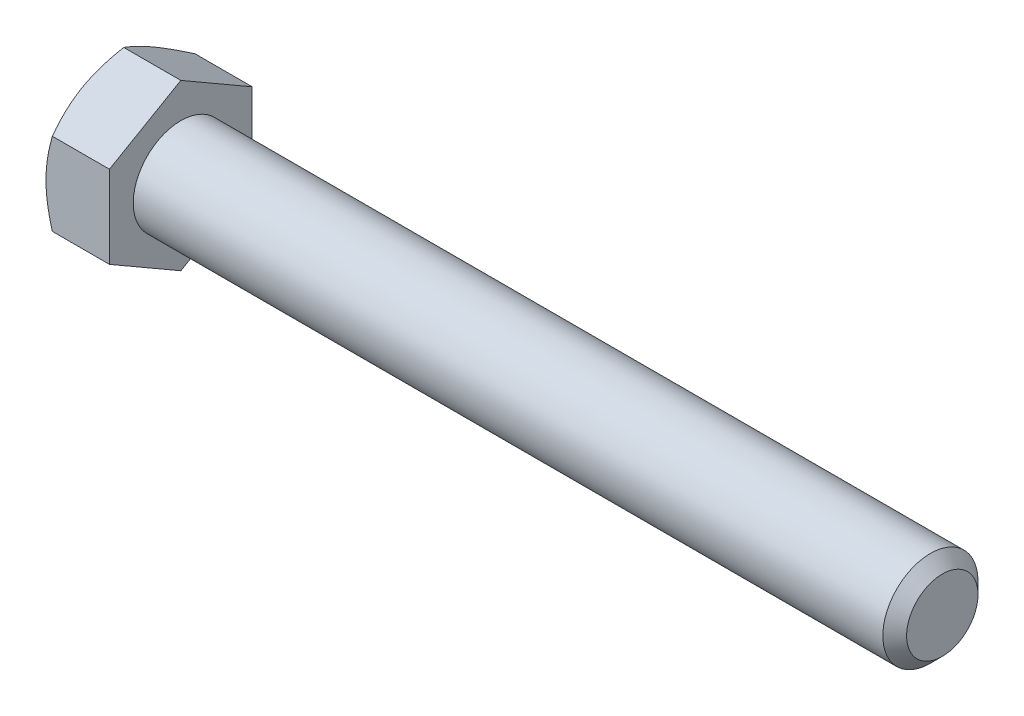
from build123d import *

# Parameters (mm, degrees)
SKETCH5_R           = 4.7625
BOSS_EXTRUDE3_DEPTH = 76.2
CHAMFER1_SIZE       = 1.190625
BOSS_EXTRUDE4_DEPTH = 6.35
SKETCH8_OUTSIDE_W   = 325.278
SKETCH8_OUTSIDE_H   = 327.488
SKETCH8_OUTSIDE_R   = 7.14375
CUT_EXTRUDE3_DEPTH  = 84.268120447
CUT_EXTRUDE3_DRAFT  = -60


with BuildPart() as part:
    # Sketch5 → Boss-Extrude3 (new body)
    with BuildSketch(Plane(origin=(41.275, 0, 0), x_dir=(0, 0, -1), z_dir=(1, 0, 0))):
        Circle(SKETCH5_R)
    extrude(amount=-BOSS_EXTRUDE3_DEPTH)

    # Chamfer1
    chamfer1_edges = [part.edges().sort_by_distance(p)[0] for p in [
        (41.275, 0, 4.7625),
    ]]
    chamfer(chamfer1_edges, length=CHAMFER1_SIZE)

    # Sketch11 → Revolve1 (revolve)
    with BuildSketch(Plane.XY):
        Polygon((-34.925, 4.7625), (-34.925, 0), (20.6375, 0), (15.875, 4.7625), align=None)
    revolve(axis=Axis((-34.925, 0, 0), (1, 0, 0)))

    # Sketch6 → Boss-Extrude4 (add)
    with BuildSketch(Plane.ZY.offset(34.925)):
        Polygon((7.14375, 4.124445986), (0, 8.248891971), (-7.14375, 4.124445986), (-7.14375, -4.124445986), (0, -8.248891971), (7.14375, -4.124445986), align=None)
    extrude(amount=BOSS_EXTRUDE4_DEPTH)


with BuildPart() as cut_extrude3_tool:
    # Sketch8 outside → Cut-Extrude3 (with draft: the straight prism first)
    with BuildSketch(Plane.ZY.offset(41.275)):
        Rectangle(SKETCH8_OUTSIDE_W, SKETCH8_OUTSIDE_H)
        Circle(SKETCH8_OUTSIDE_R, mode=Mode.SUBTRACT)
    extrude(amount=-CUT_EXTRUDE3_DEPTH)
    # Cut-Extrude3: the draft: its side faces are tilted about the plane it starts from
    cut_extrude3_sides = [cut_extrude3_tool.faces().sort_by_distance(p)[0] for p in [
        (0.859060224, -163.744, 0),
        (0.859060224, 0, 162.639),
        (0.859060224, 163.744, 0),
        (0.859060224, 0, -162.639),
        (0.859060224, 0, -7.14375),
    ]]
    draft(cut_extrude3_sides, Plane.ZY.offset(41.275), CUT_EXTRUDE3_DRAFT)


with BuildPart() as part_1:
    add(part.part)

    # Cut-Extrude3: cut by cut_extrude3_tool
    add(cut_extrude3_tool.part, mode=Mode.SUBTRACT)


solid = part_1.part
